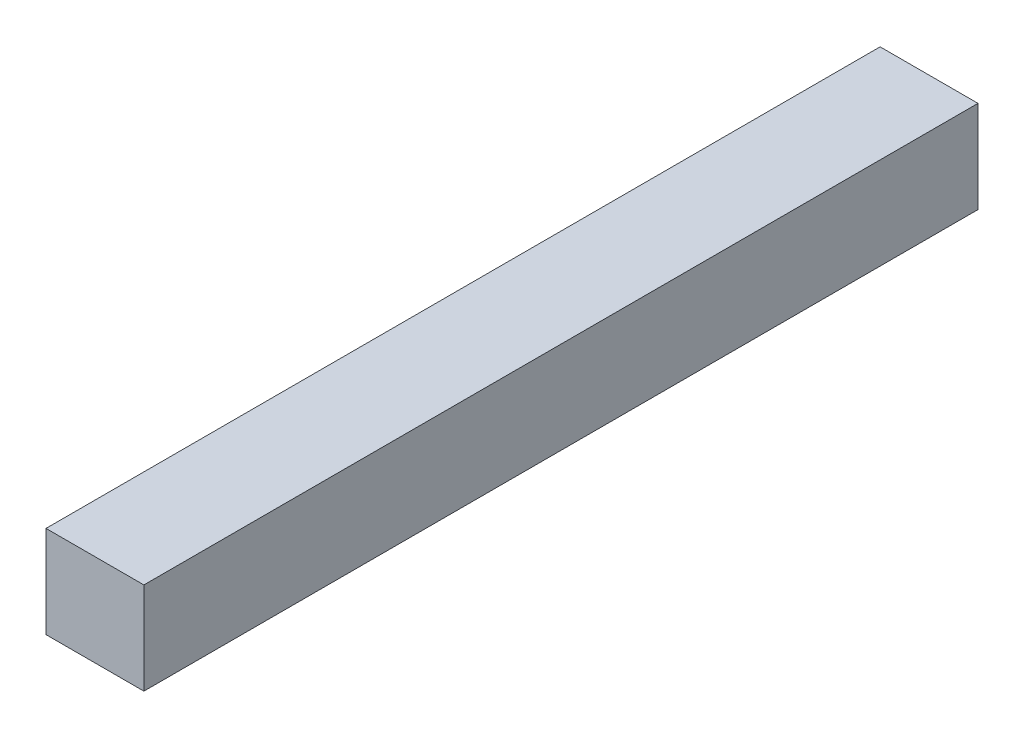
from build123d import *

# Parameters (mm, degrees)
SKETCH1_W           = 50
SKETCH1_H           = 47
BOSS_EXTRUDE1_DEPTH = 426


with BuildPart() as part:
    # Sketch1 → Boss-Extrude1 (new body)
    with BuildSketch(Plane.XY):
        with Locations((-0.0818587, -4.790322581)):
            Rectangle(SKETCH1_W, SKETCH1_H)
    extrude(amount=BOSS_EXTRUDE1_DEPTH)


solid = part.part
